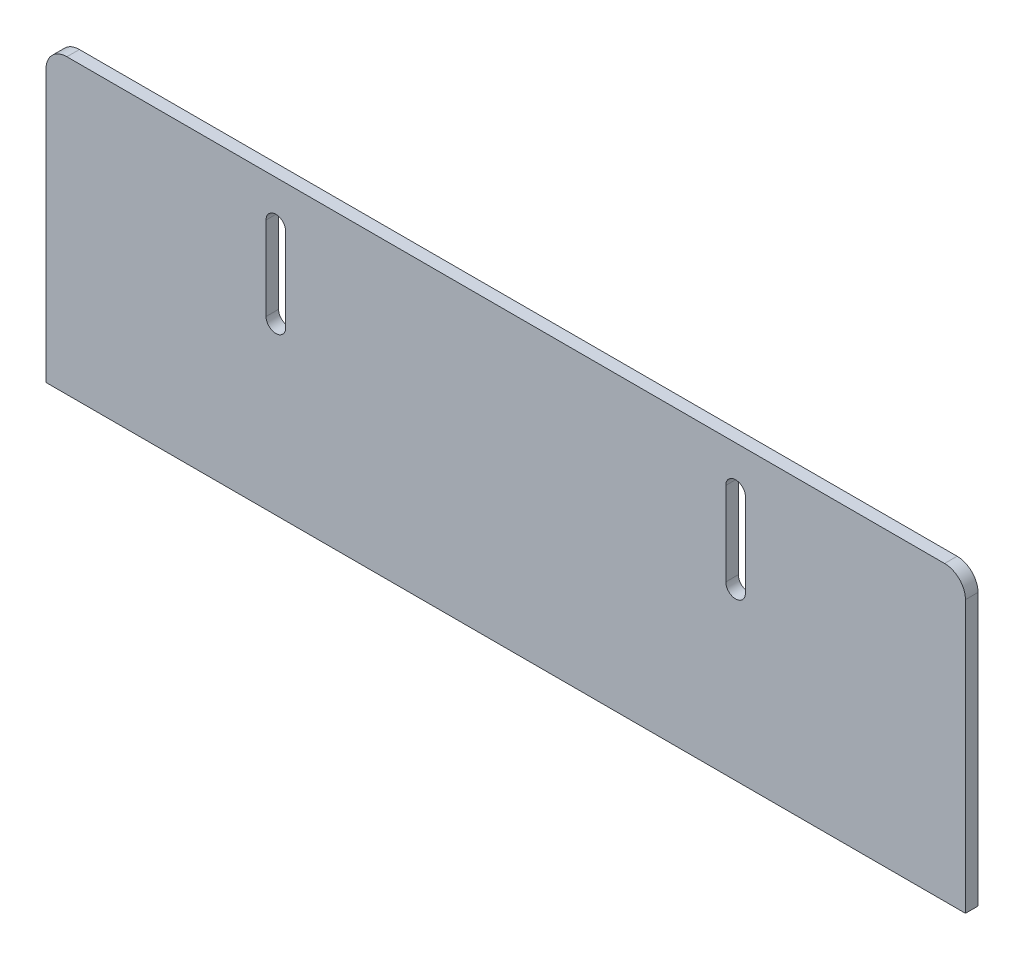
from build123d import *

# Parameters (mm, degrees)
EXTRUDE_1_DEPTH = 3


with BuildPart() as part:
    # 草图1 → 凸台-拉伸1 (new body)
    with BuildSketch(Plane.XY):
        with BuildLine():
            Line((0, 0), (220, 0))
            Line((220, 0), (220, 65))
            ThreePointArc((220, 65), (218.535533906, 68.535533906), (215, 70))
            Line((215, 70), (5, 70))
            ThreePointArc((5, 70), (1.464466094, 68.535533906), (0, 65))
            Line((0, 65), (0, 0))
        make_face()
        with BuildLine():
            Line((52.648985665, 60), (52.648985665, 40))
            ThreePointArc((52.648985665, 40), (55, 37.648985665), (57.351014335, 40))
            Line((57.351014335, 40), (57.351014335, 60))
            ThreePointArc((57.351014335, 60), (55, 62.351014335), (52.648985665, 60))
        make_face(mode=Mode.SUBTRACT)
        with BuildLine():
            Line((162.648985665, 60), (162.648985665, 40))
            ThreePointArc((162.648985665, 40), (165, 37.648985665), (167.351014335, 40))
            Line((167.351014335, 40), (167.351014335, 60))
            ThreePointArc((167.351014335, 60), (165, 62.351014335), (162.648985665, 60))
        make_face(mode=Mode.SUBTRACT)
    extrude(amount=EXTRUDE_1_DEPTH)


solid = part.part
